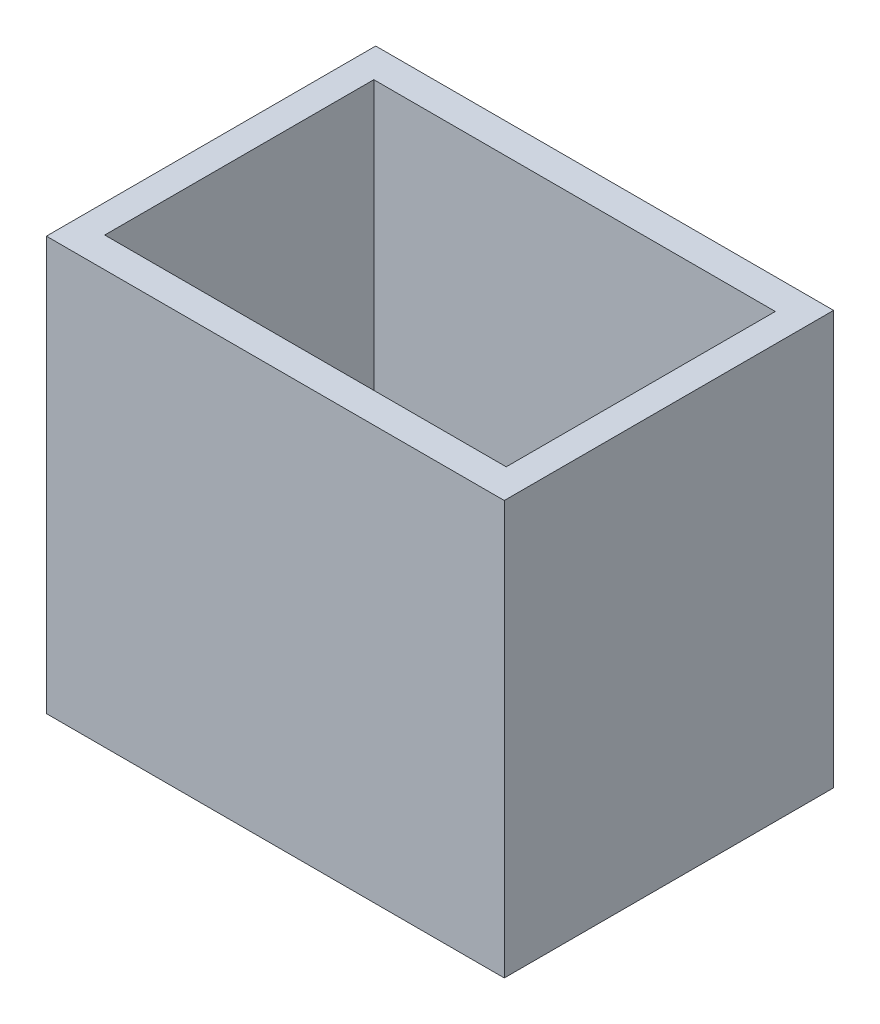
from build123d import *

# Parameters (mm, degrees)
SKETCH1_W           = 24.36
SKETCH1_H           = 17.52
BOSS_EXTRUDE1_DEPTH = 22
SKETCH2_W           = 21.359036513
SKETCH2_H           = 14.315848523
CUT_EXTRUDE1_DEPTH  = 21


with BuildPart() as part:
    # Sketch1 → Boss-Extrude1 (new body)
    with BuildSketch(Plane(origin=(0, 0, 0), x_dir=(1, 0, 0), z_dir=(0, 1, 0))):
        with Locations((-20.011114184, -9.964738068)):
            Rectangle(SKETCH1_W, SKETCH1_H)
    extrude(amount=BOSS_EXTRUDE1_DEPTH)

    # Sketch2 → Cut-Extrude1 (cut)
    with BuildSketch(Plane(origin=(0, 22, 0), x_dir=(1, 0, 0), z_dir=(0, 1, 0))):
        with Locations((-20.010632441, -9.964185338)):
            Rectangle(SKETCH2_W, SKETCH2_H)
    extrude(amount=-CUT_EXTRUDE1_DEPTH, mode=Mode.SUBTRACT)


solid = part.part
